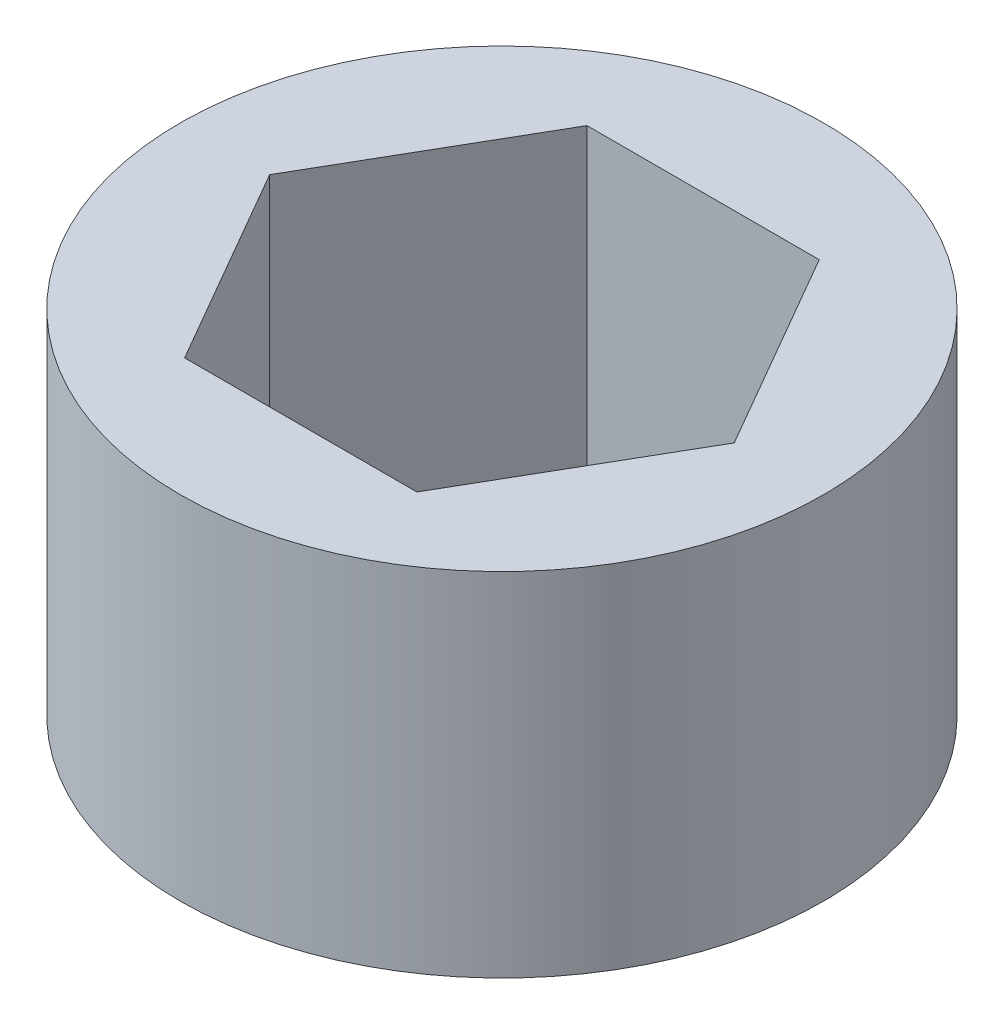
from build123d import *

# Parameters (mm, degrees)
SKETCH1_R           = 10.16
BOSS_EXTRUDE1_DEPTH = 11.1125


with BuildPart() as part:
    # Sketch1 → Boss-Extrude1 (new body)
    with BuildSketch(Plane(origin=(0, 0, 0), x_dir=(1, 0, 0), z_dir=(0, 1, 0))):
        with Locations(Location((0, 0, 0), (0, 0, 270))):
            Circle(SKETCH1_R)
        Polygon((3.666174209, -6.35), (7.332348419, 0), (3.666174209, 6.35), (-3.666174209, 6.35), (-7.332348419, 0), (-3.666174209, -6.35), align=None, mode=Mode.SUBTRACT)
    extrude(amount=BOSS_EXTRUDE1_DEPTH)


solid = part.part
